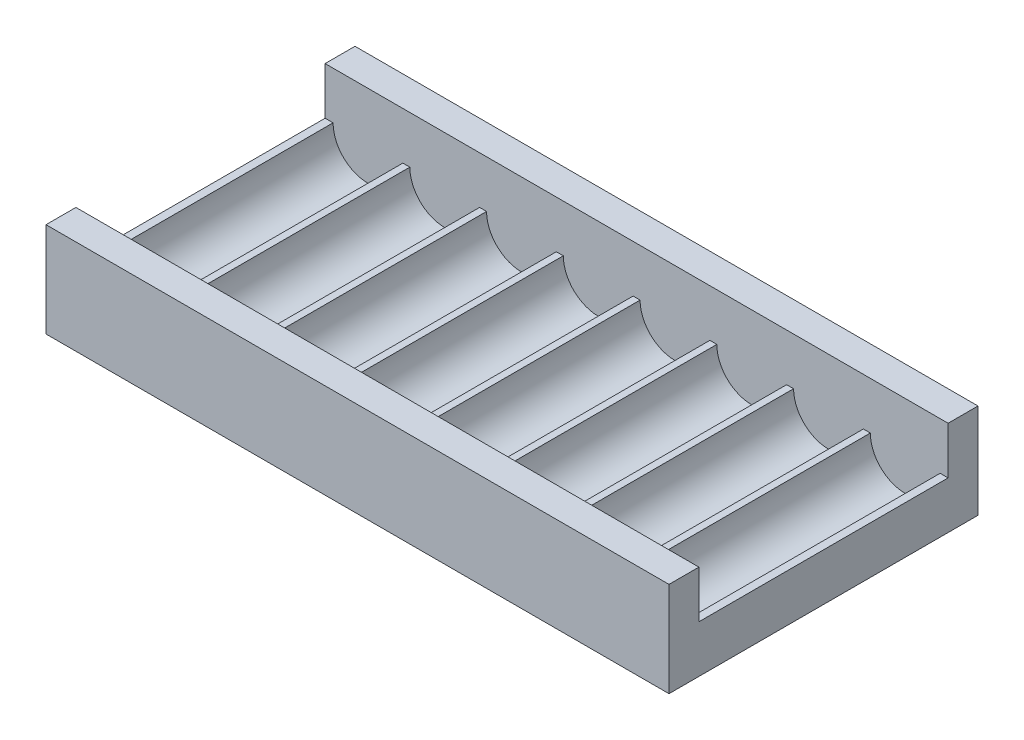
from build123d import *

# Parameters (mm, degrees)
SKETCH_1_W      = 125
SKETCH_1_H      = 19
EXTRUDE_1_DEPTH = 6
EXTRUDE_2_DEPTH = 50
SKETCH_3_W      = 125
SKETCH_3_H      = 19
EXTRUDE_3_DEPTH = 6


with BuildPart() as part:
    # 草图1 → 凸台-拉伸1 (new body)
    with BuildSketch(Plane.XY):
        Rectangle(SKETCH_1_W, SKETCH_1_H)
    extrude(amount=EXTRUDE_1_DEPTH)

    # 草图2 → 凸台-拉伸2 (add)
    with BuildSketch(Plane.XY.offset(6)):
        with BuildLine():
            Line((-62.5, 0), (-60.9, 0))
            ThreePointArc((-60.9, 0), (-53.9, -7), (-46.9, 0))
            Line((-46.9, 0), (-45.5, 0))
            ThreePointArc((-45.5, 0), (-38.5, -7), (-31.5, 0))
            Line((-31.5, 0), (-30.1, 0))
            ThreePointArc((-30.1, 0), (-23.1, -7), (-16.1, 0))
            Line((-16.1, 0), (-14.7, 0))
            ThreePointArc((-14.7, 0), (-7.7, -7), (-0.7, 0))
            Line((-0.7, 0), (0.7, 0))
            ThreePointArc((0.7, 0), (7.7, -7), (14.7, 0))
            Line((14.7, 0), (16.1, 0))
            ThreePointArc((16.1, 0), (23.1, -7), (30.1, 0))
            Line((30.1, 0), (31.5, 0))
            ThreePointArc((31.5, 0), (38.5, -7), (45.5, 0))
            Line((45.5, 0), (46.9, 0))
            ThreePointArc((46.9, 0), (53.9, -7), (60.9, 0))
            Line((60.9, 0), (62.5, 0))
            Line((62.5, 0), (62.5, -9.5))
            Line((62.5, -9.5), (-62.5, -9.5))
            Line((-62.5, -9.5), (-62.5, 0))
        make_face()
    extrude(amount=EXTRUDE_2_DEPTH)

    # 草图3 → 凸台-拉伸3 (add)
    with BuildSketch(Plane.XY.offset(56)):
        Rectangle(SKETCH_3_W, SKETCH_3_H)
    extrude(amount=EXTRUDE_3_DEPTH)


solid = part.part
